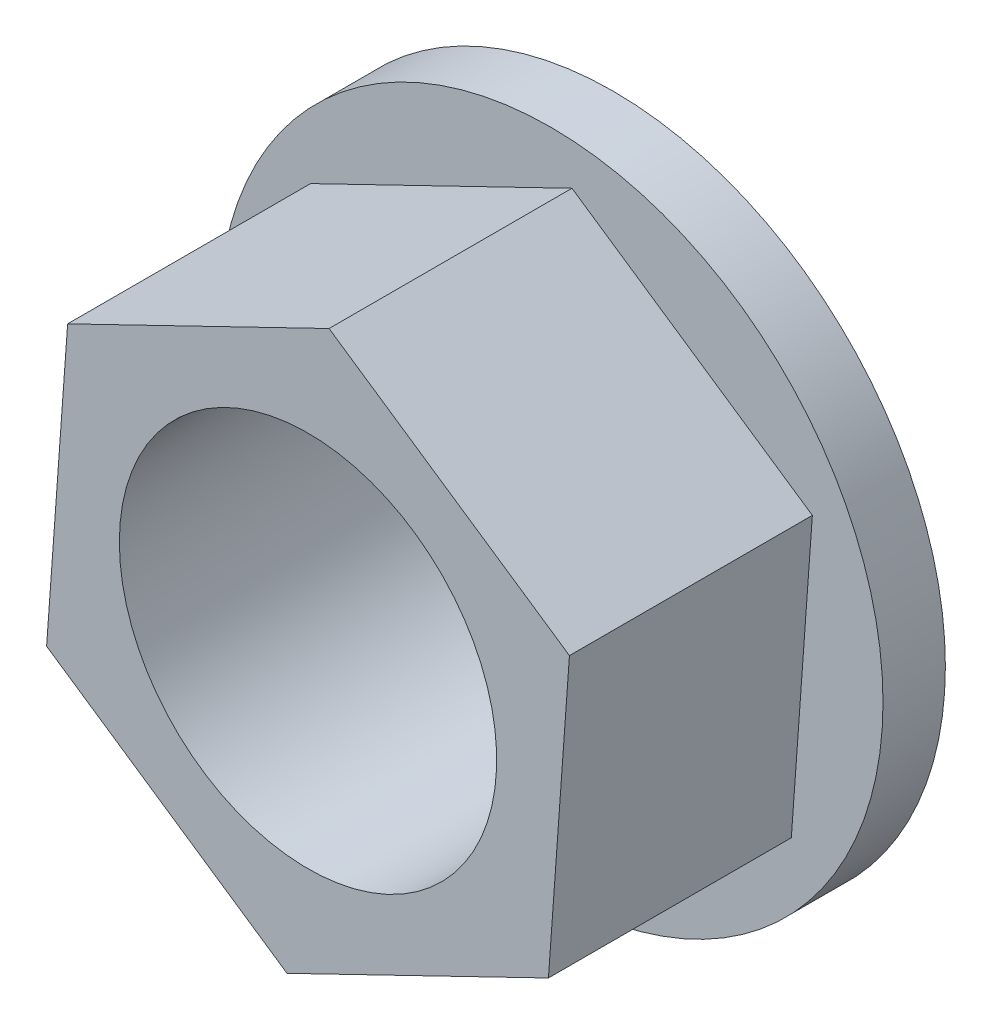
from build123d import *

# Parameters (mm, degrees)
SKETCH1_R      = 4.191
EXTRUDE1_DEPTH = 0.7874
EXTRUDE2_DEPTH = 3.85318
SKETCH3_R      = 2.38125
EXTRUDE3_DEPTH = 8.069367589


with BuildPart() as part:
    # Sketch1 → Extrude1 (new body)
    with BuildSketch(Plane.XY):
        Circle(SKETCH1_R)
    extrude(amount=EXTRUDE1_DEPTH)

    # Sketch2 → Extrude2 (add)
    with BuildSketch(Plane.XY):
        Polygon((-0.265291692, -3.656563093), (3.034030683, -2.058030891), (3.299322375, 1.598532202), (0.265291692, 3.656563093), (-3.034030683, 2.058030891), (-3.299322375, -1.598532202), align=None)
    extrude(amount=EXTRUDE2_DEPTH)

    # Sketch3 → Extrude3 (cut, through all)
    with BuildSketch(Plane(origin=(0, 0, 0), x_dir=(-1, 0, 0), z_dir=(0, 0, -1))):
        Circle(SKETCH3_R)
    extrude(amount=-EXTRUDE3_DEPTH, mode=Mode.SUBTRACT)


solid = part.part
